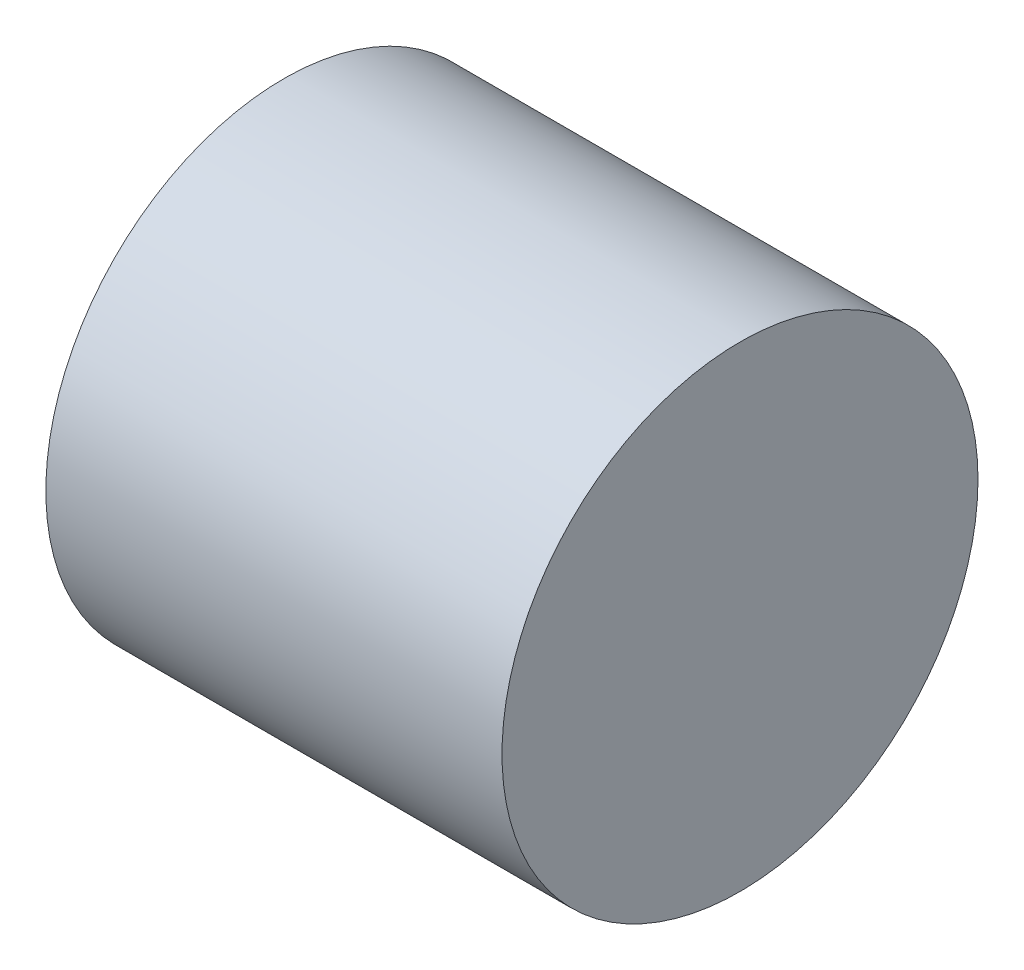
from build123d import *

# Parameters (mm, degrees)
SKETCH1_R           = 12
BOSS_EXTRUDE1_DEPTH = 23
CUT_EXTRUDE1_DEPTH  = 10


with BuildPart() as part:
    # Sketch1 → Boss-Extrude1 (new body)
    with BuildSketch(Plane(origin=(0, 0, 0), x_dir=(0, 0, -1), z_dir=(1, 0, 0))):
        Circle(SKETCH1_R)
    extrude(amount=BOSS_EXTRUDE1_DEPTH)

    # Sketch2 → Cut-Extrude1 (cut)
    with BuildSketch(Plane.ZY):
        with BuildLine():
            ThreePointArc((3.5, 0), (-0.505293538, 3.463333429), (-3.354101966, -1))
            Line((-3.354101966, -1), (3.354101966, -1))
            ThreePointArc((3.354101966, -1), (3.463333429, -0.505293538), (3.5, 0))
        make_face()
    extrude(amount=-CUT_EXTRUDE1_DEPTH, mode=Mode.SUBTRACT)


solid = part.part
